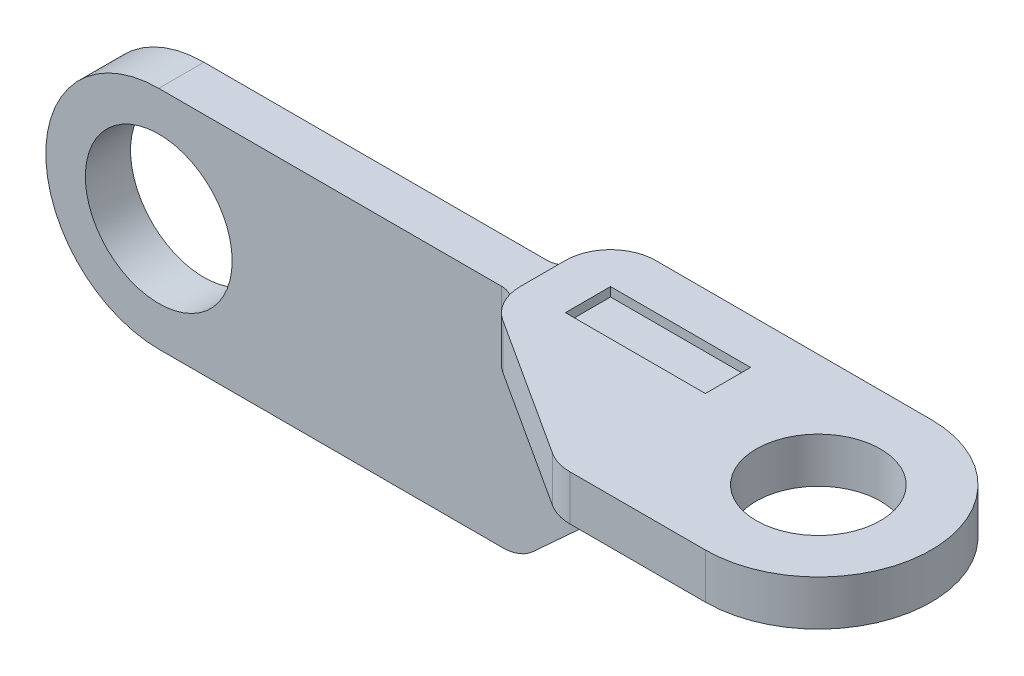
from build123d import *

# Parameters (mm, degrees)
SKETCH12_R          = 2.75
BOSS_EXTRUDE5_DEPTH = 2
BOSS_EXTRUDE6_START = -1
SKETCH20_R          = 3.25
BOSS_EXTRUDE6_DEPTH = 2
SKETCH21_W          = 6.2
SKETCH21_H          = 2
BOSS_EXTRUDE7_DEPTH = 2
BOSS_EXTRUDE8_DEPTH = 2
FILLET1_R           = 1


with BuildPart() as part:
    # Sketch12 → Boss-Extrude5 (new body)
    with BuildSketch(Plane(origin=(0, 0, 0), x_dir=(1, 0, 0), z_dir=(0, 1, 0))):
        with BuildLine():
            Line((0, 5), (-5, 5))
            Line((-5, 5), (-5, -5))
            Line((-5, -5), (0, -5))
            ThreePointArc((0, -5), (5, 0), (0, 5))
        make_face()
        with Locations(Location((0, 0, 0), (0, 0, 270))):
            Circle(SKETCH12_R, mode=Mode.SUBTRACT)
    extrude(amount=BOSS_EXTRUDE5_DEPTH)

    # Sketch21 → Boss-Extrude7 (add)
    with BuildSketch(Plane.XZ):
        with BuildLine():
            Line((-5, -5), (-6, -5))
            Line((-6, -5), (-12.2, -5))
            ThreePointArc((-12.2, -5), (-13.614213562, -4.414213562), (-14.2, -3))
            Line((-14.2, -3), (-14.2, -1))
            ThreePointArc((-14.2, -1), (-13.956204356, -0.043053679), (-13.28425374, 0.680593296))
            Line((-13.28425374, 0.680593296), (-7.08425374, 4.680593296))
            ThreePointArc((-7.08425374, 4.680593296), (-6.565160777, 4.918487242), (-6, 5))
            Line((-6, 5), (-5, 5))
            Line((-5, 5), (-5, -5))
        make_face()
        with Locations((-9.1, -2)):
            Rectangle(SKETCH21_W, SKETCH21_H, mode=Mode.SUBTRACT)
    extrude(amount=-BOSS_EXTRUDE7_DEPTH)



with BuildPart() as body_2:
    # Sketch20 → Boss-Extrude6 (new body)
    with BuildSketch(Plane.XY.offset(BOSS_EXTRUDE6_START)):
        with BuildLine():
            Line((-15.2, -8.4), (-15.2, 1.6))
            Line((-15.2, 1.6), (-30.2, 1.6))
            ThreePointArc((-30.2, 1.6), (-35.2, -3.4), (-30.2, -8.4))
            Line((-30.2, -8.4), (-15.2, -8.4))
        make_face()
        with Locations((-30.2, -3.4)):
            Circle(SKETCH20_R, mode=Mode.SUBTRACT)
    extrude(amount=-BOSS_EXTRUDE6_DEPTH)


with BuildPart() as part_1:
    add(part.part)

    add(body_2.part)  # Boss-Extrude8 merges body 2
    # Sketch22 → Boss-Extrude8 (add)
    with BuildSketch(Plane.XY.offset(-1)):
        with BuildLine():
            Line((-6.648176396, -1.473965041), (-13.626436158, -7.873965041))
            ThreePointArc((-13.626436158, -7.873965041), (-14.252977088, -8.26385757), (-14.978259763, -8.4))
            Line((-14.978259763, -8.4), (-15.2, -8.4))
            Line((-15.2, -8.4), (-15.2, 1.6))
            Line((-15.2, 1.6), (-6, 1.6))
            Line((-6, 1.6), (-6, 0))
            ThreePointArc((-6, 0), (-6.169201375, -0.805094029), (-6.648176396, -1.473965041))
        make_face()
    extrude(amount=-BOSS_EXTRUDE8_DEPTH)

    # Fillet1
    fillet1_edges = [part_1.edges().sort_by_distance(p)[0] for p in [
        (-6, 0, -2),
        (-14.2, 0.8, -1),
        (-14.2, 0.8, -3),
        (-10.1, 0, -3),
        (-10.1, 0, -1),
    ]]
    fillet(fillet1_edges, radius=FILLET1_R)


solid = part_1.part
